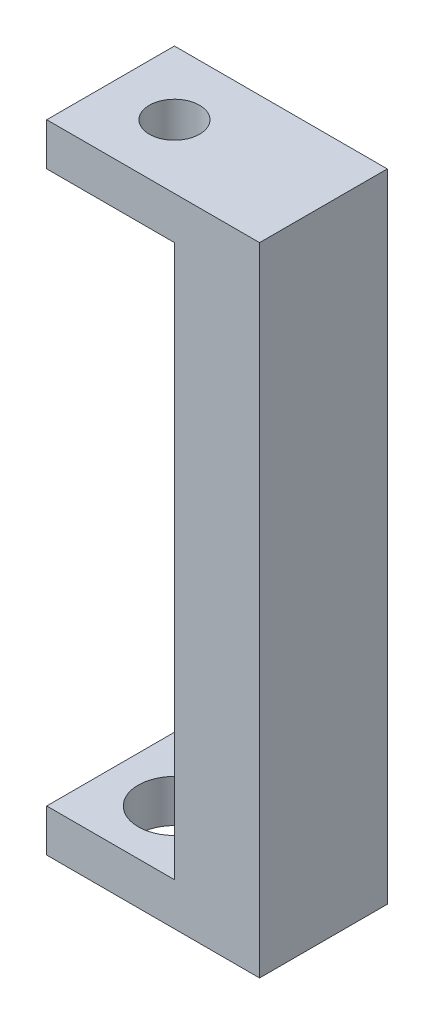
from build123d import *

# Parameters (mm, degrees)
BOSS_EXTRUDE1_DEPTH = 7.62
SKETCH2_R           = 2.159
CUT_EXTRUDE1_DEPTH  = 38.309477646
SKETCH3_R           = 1.5
CUT_EXTRUDE2_DEPTH  = 38.309477646


with BuildPart() as part:
    # Sketch1 → Boss-Extrude1 (new body)
    with BuildSketch(Plane.XY):
        Polygon((-8.747635235, -17.04359987), (-8.747635235, -19.58359987), (3.952364765, -19.58359987), (3.952364765, 18.41640013), (-8.747635235, 18.41640013), (-8.747635235, 15.87640013), (-1.127635235, 15.87640013), (-1.127635235, -17.04359987), align=None)
    extrude(amount=BOSS_EXTRUDE1_DEPTH)

    # Sketch2 → Cut-Extrude1 (cut, through all)
    with BuildSketch(Plane(origin=(0, -17.04359987, 0), x_dir=(1, 0, 0), z_dir=(0, 1, 0))):
        with Locations(Location((-4.937635235, -3.81, 0), (0, 0, 270))):
            Circle(SKETCH2_R)
    extrude(amount=-CUT_EXTRUDE1_DEPTH, mode=Mode.SUBTRACT)

    # Sketch3 → Cut-Extrude2 (cut, through all)
    with BuildSketch(Plane.XZ.offset(-15.87640013)):
        with Locations(Location((-4.937635235, 3.81, 0), (0, 0, 270))):
            Circle(SKETCH3_R)
    extrude(amount=-CUT_EXTRUDE2_DEPTH, mode=Mode.SUBTRACT)


solid = part.part
